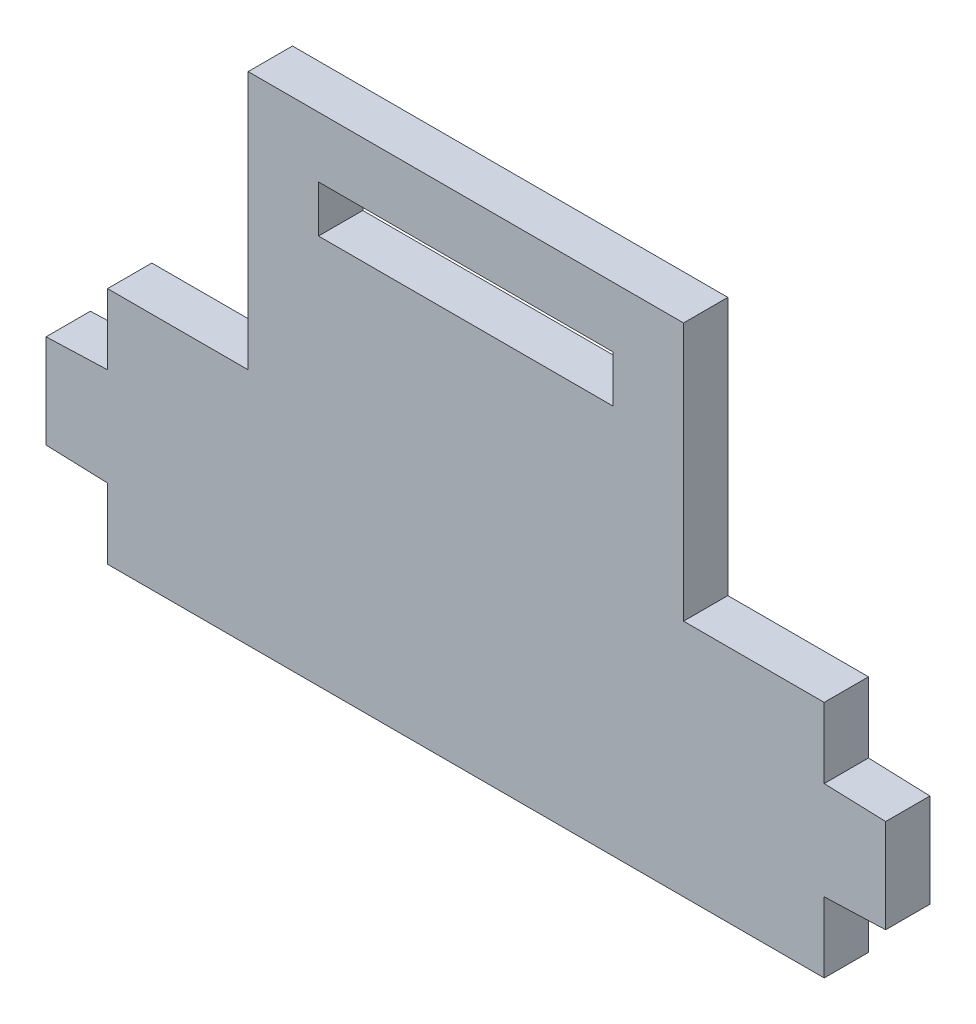
from build123d import *

# Parameters (mm, degrees)
SKETCH1_W           = 39.920556732
SKETCH1_H           = 6.35
BOSS_EXTRUDE1_DEPTH = 6


with BuildPart() as part:
    # Sketch1 → Boss-Extrude1 (new body)
    with BuildSketch(Plane(origin=(0, 0, 2.54), x_dir=(-1, 0, 0), z_dir=(0, 0, -1))):
        Polygon((-48.535278366, 182.16527563), (-56.859833665, 182.455975506), (-56.859833665, 195.155975506), (-48.535278366, 195.446675383), (-48.535278366, 204.971675383), (-29.485278366, 204.971675383), (-29.485278366, 239.9538), (29.485278366, 239.9538), (29.485278366, 204.971675383), (48.535278366, 204.971675383), (48.535278366, 195.446675383), (56.859833665, 195.155975506), (56.859833665, 182.455975506), (48.535278366, 182.16527563), (48.535278366, 172.64027563), (-48.535278366, 172.64027563), align=None)
        with Locations((0, 228.6)):
            Rectangle(SKETCH1_W, SKETCH1_H, mode=Mode.SUBTRACT)
    extrude(amount=-BOSS_EXTRUDE1_DEPTH)


solid = part.part
